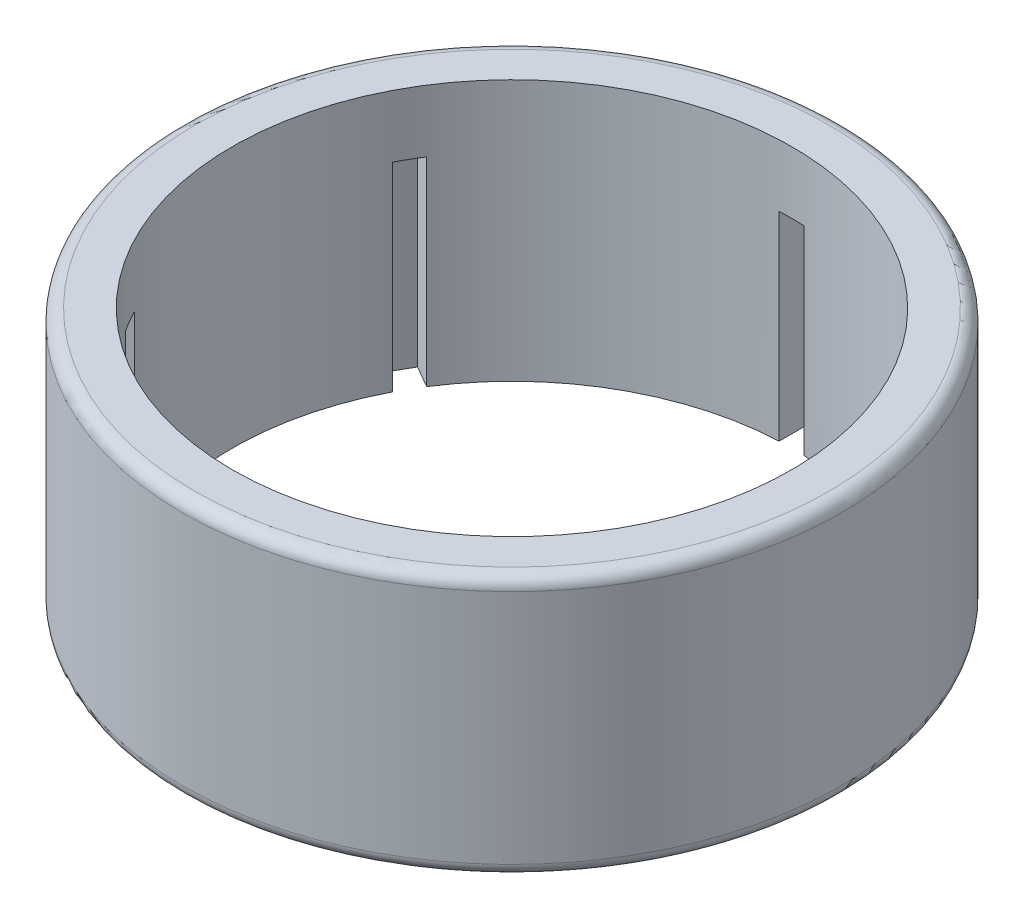
from build123d import *

# Parameters (mm, degrees)
SKETCH_1_R               = 26.5
SKETCH_1_R_2             = 22.5
EXTRUDE_1_DEPTH          = 21
CUT_EXTRUDE_1_DEPTH      = 16
PATTERN_CIRCULAR_1_COUNT = 6
FILLET_1_R               = 1


with BuildPart() as part:
    # 草图1 → 凸台-拉伸1 (new body)
    with BuildSketch(Plane(origin=(0, 0, 0), x_dir=(1, 0, 0), z_dir=(0, 1, 0))):
        with Locations(Location((0, 0, 0), (0, 0, 90))):
            Circle(SKETCH_1_R)
        with Locations(Location((0, 0, 0), (0, 0, 90))):
            Circle(SKETCH_1_R_2, mode=Mode.SUBTRACT)
    extrude(amount=EXTRUDE_1_DEPTH)

    # 草图2 → 切除-拉伸1 (cut)
    with BuildSketch(Plane.XZ):
        with BuildLine():
            ThreePointArc((-1, 22.477766793), (-0.500123564, 22.494441012), (0, 22.5))
            Line((0, 22.5), (0, 24.477766793))
            Line((0, 24.477766793), (-1, 24.477766793))
            Line((-1, 24.477766793), (-1, 22.477766793))
        make_face()
        with BuildLine():
            Line((0, 24.477766793), (0, 22.5))
            ThreePointArc((0, 22.5), (0.500123564, 22.494441012), (1, 22.477766793))
            Line((1, 22.477766793), (1, 24.477766793))
            Line((1, 24.477766793), (0, 24.477766793))
        make_face()
    cut_extrude_1 = extrude(amount=-CUT_EXTRUDE_1_DEPTH, mode=Mode.SUBTRACT)

    # 阵列(圆周)1: 切除-拉伸1 ×6 about axis
    pattern_circular_1_axis = Axis((0, 0, 0), (0, 1, 0))
    for i in range(1, PATTERN_CIRCULAR_1_COUNT):
        add(cut_extrude_1.rotate(pattern_circular_1_axis, i * 360 / PATTERN_CIRCULAR_1_COUNT), mode=Mode.SUBTRACT)

    # 圆角1
    fillet_1_edges = [part.edges().sort_by_distance(p)[0] for p in [
        (0, 0, 26.5),
        (0, 21, 26.5),
    ]]
    fillet(fillet_1_edges, radius=FILLET_1_R)


solid = part.part
